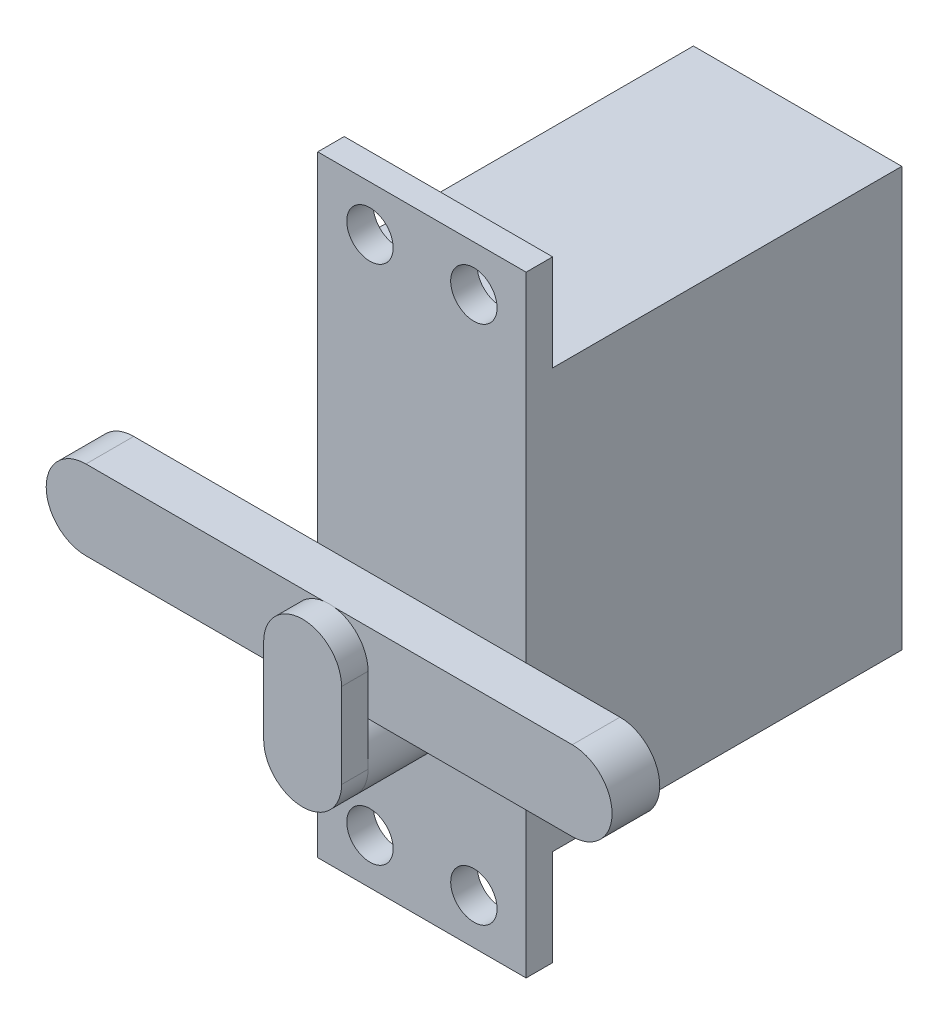
from build123d import *

# Parameters (mm, degrees)
SKETCH1_W      = 35.9918
SKETCH1_H      = 40.132
EXTRUDE1_DEPTH = 9.9822
SKETCH2_R      = 3.730476731
EXTRUDE2_DEPTH = 8.89
EXTRUDE3_DEPTH = 4.572
EXTRUDE4_DEPTH = 2.54
SKETCH5_W      = 19.9644
SKETCH5_H      = 9.215392605
SKETCH5_R      = 2.2225
SKETCH5_H_2    = 9.215392606
EXTRUDE5_DEPTH = 2.54


with BuildPart() as part:
    # Sketch1 → Extrude1 (new, symmetric)
    with BuildSketch(Plane(origin=(0, 0, 0), x_dir=(0, 0, -1), z_dir=(1, 0, 0))):
        with Locations((-36.920443218, 16.936283292)):
            Rectangle(SKETCH1_W, SKETCH1_H)
    extrude(amount=EXTRUDE1_DEPTH, both=True)

    # Sketch5 → Extrude5 (add)
    # profile 1 of 2: a face of its own
    with BuildSketch(Plane.XY.offset(54.916343218)):
        with Locations((0, 41.609979595)):
            Rectangle(SKETCH5_W, SKETCH5_H)
        with Locations((4.9784, 41.86450492)):
            Circle(SKETCH5_R, mode=Mode.SUBTRACT)
        with Locations((-4.9784, 41.86450492)):
            Circle(SKETCH5_R, mode=Mode.SUBTRACT)
    # profile 2 of 2: a face of its own
    with BuildSketch(Plane.XY.offset(54.916343218)):
        with Locations((0, -7.737413011)):
            Rectangle(SKETCH5_W, SKETCH5_H_2)
        with Locations(Location((-4.9784, -7.991938336, 0), (0, 0, 180))):
            Circle(SKETCH5_R, mode=Mode.SUBTRACT)
        with Locations(Location((4.9784, -7.991938336, 0), (0, 0, 180))):
            Circle(SKETCH5_R, mode=Mode.SUBTRACT)
    extrude(amount=-EXTRUDE5_DEPTH)


with BuildPart() as body_2:
    # Sketch2 → Extrude2 (new body)
    with BuildSketch(Plane.XY.offset(54.916343218)):
        with Locations((0, 6.293683292)):
            Circle(SKETCH2_R)
    extrude(amount=EXTRUDE2_DEPTH)


with BuildPart() as body_3:
    # Sketch3 → Extrude3 (new body)
    with BuildSketch(Plane.XY.offset(63.806343218)):
        with BuildLine():
            Line((23.293134334, 10.487985686), (-23.293134334, 10.487985686))
            ThreePointArc((-23.293134334, 10.487985686), (-27.10453386, 14.299385211), (-23.293134334, 18.110784737))
            Line((-23.293134334, 18.110784737), (23.293134334, 18.110784737))
            ThreePointArc((23.293134334, 18.110784737), (27.10453386, 14.299385211), (23.293134334, 10.487985686))
        make_face()
    extrude(amount=-EXTRUDE3_DEPTH)


with BuildPart() as body_4:
    # Sketch4 → Extrude4 (new body)
    with BuildSketch(Plane.XY.offset(63.806343218)):
        with BuildLine():
            Line((-3.730476731, 14.424128755), (-3.730476731, 6.293683292))
            ThreePointArc((-3.730476731, 6.293683292), (0, 2.563206561), (3.730476731, 6.293683292))
            Line((3.730476731, 6.293683292), (3.730476731, 14.424128755))
            ThreePointArc((3.730476731, 14.424128755), (0, 18.154605486), (-3.730476731, 14.424128755))
        make_face()
    extrude(amount=EXTRUDE4_DEPTH)


solid = Compound([part.part, body_2.part, body_3.part, body_4.part])
